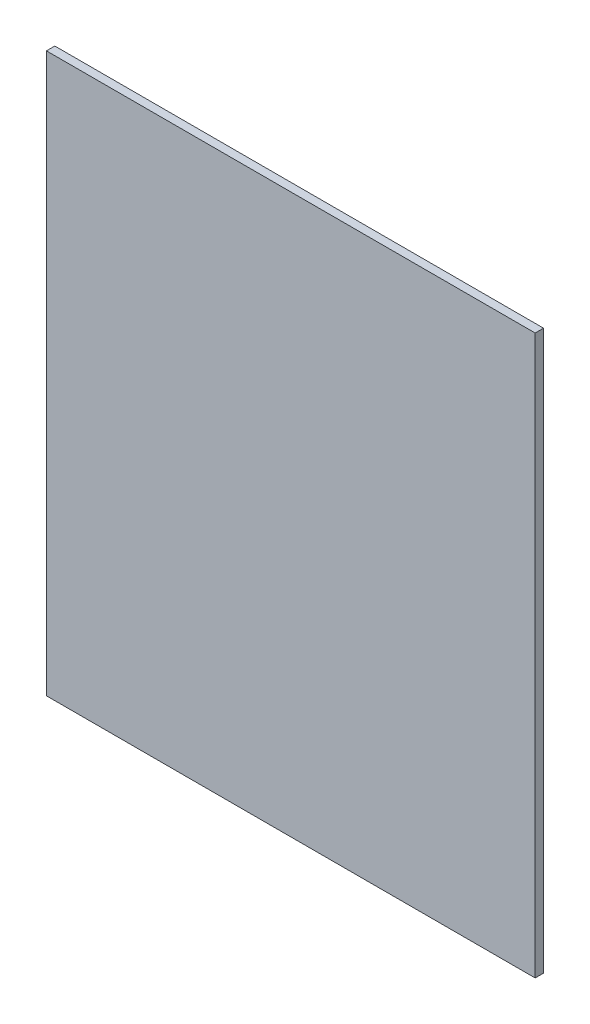
from build123d import *

# Parameters (mm, degrees)
SKETCH1_W           = 350
SKETCH1_H           = 400
BOSS_EXTRUDE1_DEPTH = 6


with BuildPart() as part:
    # Sketch1 → Boss-Extrude1 (new body)
    with BuildSketch(Plane.XY):
        with Locations((146.428571429, 177.104761905)):
            Rectangle(SKETCH1_W, SKETCH1_H)
    extrude(amount=BOSS_EXTRUDE1_DEPTH)


solid = part.part
